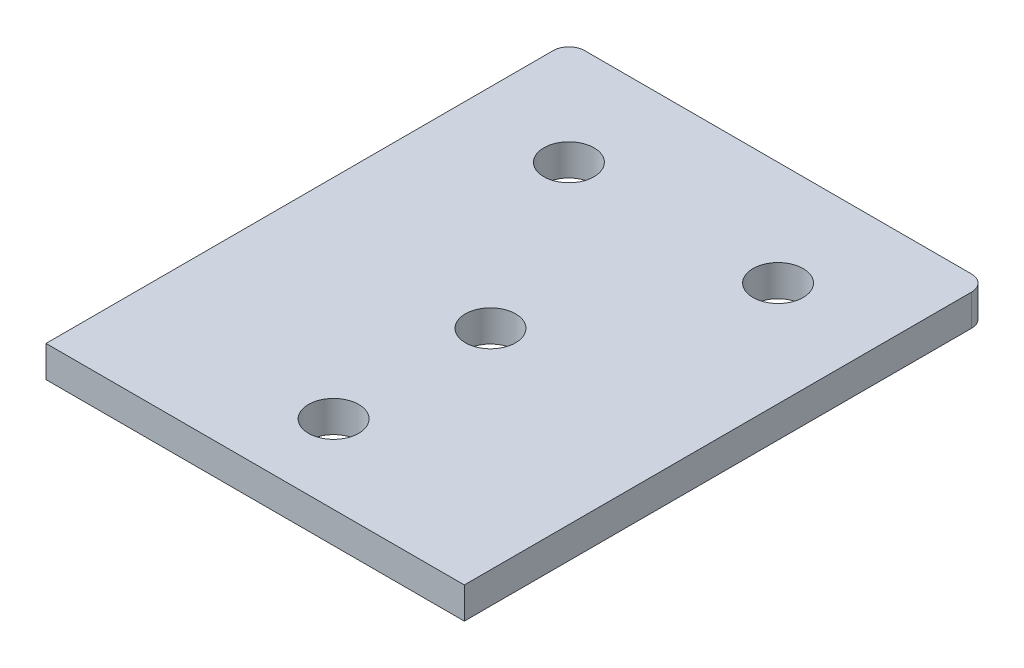
from build123d import *

# Parameters (mm, degrees)
SKETCH1_R           = 2.4
BOSS_EXTRUDE1_DEPTH = 3


with BuildPart() as part:
    # Sketch1 → Boss-Extrude1 (new body)
    with BuildSketch(Plane(origin=(0, 0, 0), x_dir=(1, 0, 0), z_dir=(0, 1, 0))):
        with BuildLine():
            Line((-18.5, 10), (18.5, 10))
            ThreePointArc((18.5, 10), (19.560660172, 9.560660172), (20, 8.5))
            Line((20, 8.5), (20, -40))
            Line((20, -40), (-20, -40))
            Line((-20, -40), (-20, 8.5))
            ThreePointArc((-20, 8.5), (-19.560660172, 9.560660172), (-18.5, 10))
        make_face()
        with Locations(Location((-10, 0, 0), (0, 0, 270))):
            Circle(SKETCH1_R, mode=Mode.SUBTRACT)
        with Locations(Location((10, 0, 0), (0, 0, 270))):
            Circle(SKETCH1_R, mode=Mode.SUBTRACT)
        with Locations(Location((0, -32.5, 0), (0, 0, 270))):
            Circle(SKETCH1_R, mode=Mode.SUBTRACT)
        with Locations(Location((0, -17.5, 0), (0, 0, 270))):
            Circle(SKETCH1_R, mode=Mode.SUBTRACT)
    extrude(amount=BOSS_EXTRUDE1_DEPTH)


solid = part.part
